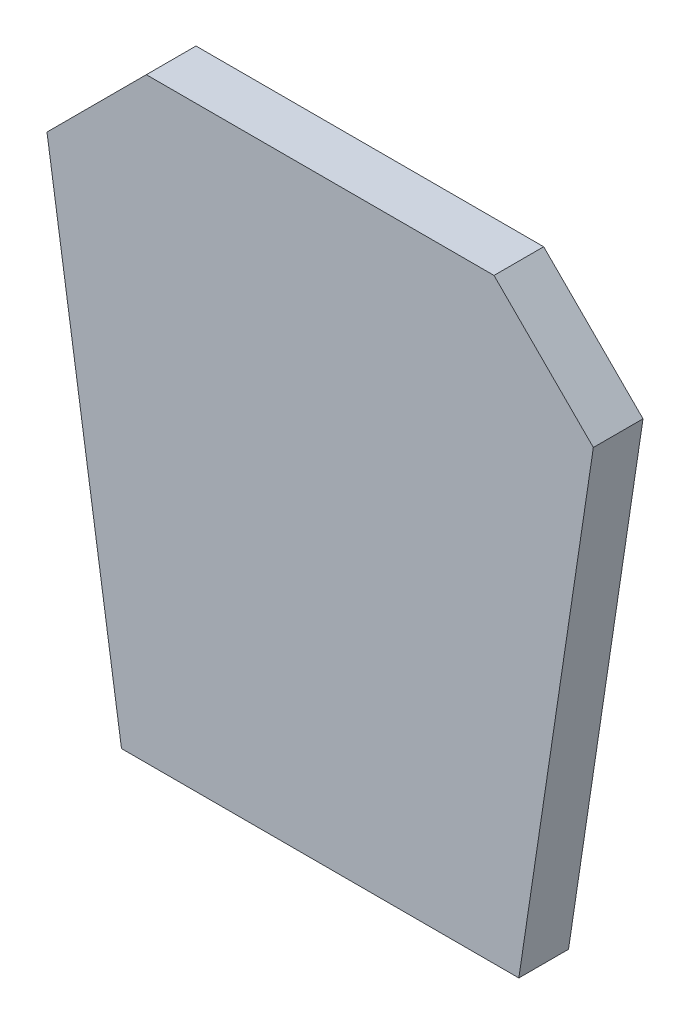
from build123d import *

# Parameters (mm, degrees)
BOSS_EXTRUDE1_DEPTH = 50


with BuildPart() as part:
    # Sketch1 → Boss-Extrude1 (new body)
    with BuildSketch(Plane.XY):
        Polygon((200, 0), (-200, 0), (-275, 500), (-175, 600), (0, 600), (175, 600), (275, 500), align=None)
    extrude(amount=BOSS_EXTRUDE1_DEPTH)


solid = part.part
